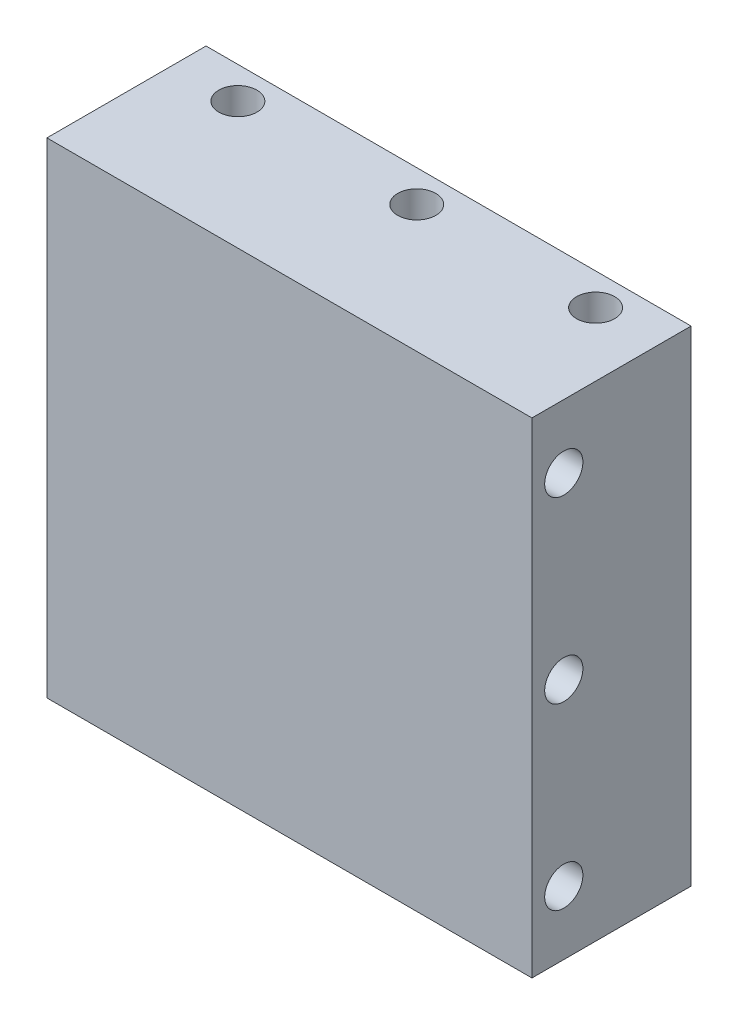
from build123d import *

# Parameters (mm, degrees)
SKETCH1_W           = 152.4
SKETCH1_H           = 152.4
BOSS_EXTRUDE1_DEPTH = 50
SKETCH2_R           = 6
CUT_EXTRUDE1_DEPTH  = 178.573083546
SKETCH4_R           = 6
CUT_EXTRUDE2_DEPTH  = 178.573083546


with BuildPart() as part:
    # Sketch1 → Boss-Extrude1 (new body)
    with BuildSketch(Plane.XY):
        Rectangle(SKETCH1_W, SKETCH1_H)
    extrude(amount=BOSS_EXTRUDE1_DEPTH)

    # Sketch2 → Cut-Extrude1 (cut, through all)
    with BuildSketch(Plane(origin=(76.2, 0, 0), x_dir=(0, 0, -1), z_dir=(1, 0, 0))):
        with Locations(Location((-40, 56.2, 0), (0, 0, 90))):
            Circle(SKETCH2_R)
        with Locations(Location((-40, 0, 0), (0, 0, 90))):
            Circle(SKETCH2_R)
        with Locations(Location((-40, -56.2, 0), (0, 0, 90))):
            Circle(SKETCH2_R)
    extrude(amount=-CUT_EXTRUDE1_DEPTH, mode=Mode.SUBTRACT)

    # Sketch4 → Cut-Extrude2 (cut, through all)
    with BuildSketch(Plane(origin=(0, 76.2, 0), x_dir=(1, 0, 0), z_dir=(0, 1, 0))):
        with Locations(Location((-56.2, -10, 0), (0, 0, 270))):
            Circle(SKETCH4_R)
        with Locations(Location((0, -10, 0), (0, 0, 270))):
            Circle(SKETCH4_R)
        with Locations(Location((56.2, -10, 0), (0, 0, 270))):
            Circle(SKETCH4_R)
    extrude(amount=-CUT_EXTRUDE2_DEPTH, mode=Mode.SUBTRACT)


solid = part.part
